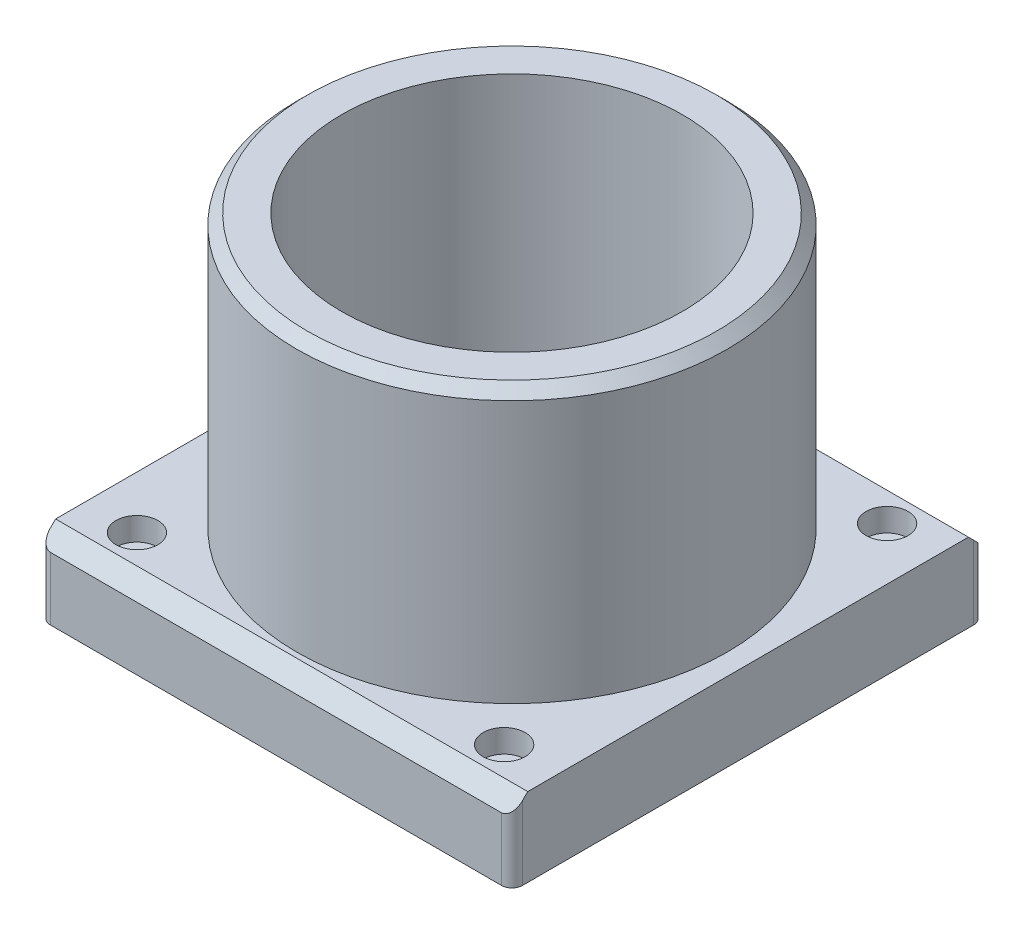
from build123d import *

# Parameters (mm, degrees)
ESQUISSE1_W                                        = 90
ESQUISSE1_H                                        = 90
BOSS_EXTRU_1_DEPTH                                 = 15
ESQUISSE2_R                                        = 41
BOSS_EXTRU_2_DEPTH                                 = 52
CHANFREIN1_SIZE                                    = 3
CONG_1_R                                           = 2
CHANFREIN2_SIZE                                    = 2
CHAMBRAGE_POUR_VIS_T_TE_HEXAGONALE_M41_D           = 4.5
CHAMBRAGE_POUR_VIS_T_TE_HEXAGONALE_M41_CBORE_D     = 8
CHAMBRAGE_POUR_VIS_T_TE_HEXAGONALE_M41_CBORE_DEPTH = 4.4
ESQUISSE6_R                                        = 32.5
ENL_V_MAT_EXTRU_1_DEPTH                            = 93.406709713


with BuildPart() as part:
    # Esquisse1 → Boss.-Extru.1 (new body)
    with BuildSketch(Plane(origin=(0, 0, 0), x_dir=(1, 0, 0), z_dir=(0, 1, 0))):
        Rectangle(ESQUISSE1_W, ESQUISSE1_H)
    extrude(amount=BOSS_EXTRU_1_DEPTH)

    # Esquisse2 → Boss.-Extru.2 (add)
    with BuildSketch(Plane(origin=(0, 15, 0), x_dir=(1, 0, 0), z_dir=(0, 1, 0))):
        with Locations(Location((0, 0, 0), (0, 0, 90))):
            Circle(ESQUISSE2_R)
    extrude(amount=BOSS_EXTRU_2_DEPTH)

    # Chanfrein1
    chanfrein1_edges = [part.edges().sort_by_distance(p)[0] for p in [
        (0, 15, -45),
        (0, 15, 45),
    ]]
    chamfer(chanfrein1_edges, length=CHANFREIN1_SIZE)

    # Congé1
    cong_1_edges = [part.edges().sort_by_distance(p)[0] for p in [
        (-45, 6, 45),
        (-45, 6, -45),
        (45, 6, -45),
        (45, 6, 45),
    ]]
    fillet(cong_1_edges, radius=CONG_1_R)

    # Chanfrein2
    chanfrein2_edges = [part.edges().sort_by_distance(p)[0] for p in [
        (0, 67, 41),
    ]]
    chamfer(chanfrein2_edges, length=CHANFREIN2_SIZE)

    # Chambrage pour vis à tête hexagonale M41 (through all)
    with Locations(Plane(origin=(0, 15, 0), x_dir=(1, 0, 0), z_dir=(0, 1, 0))):
        with Locations((-35, 36.5), (35, 36.5), (-35, -36.5), (35, -36.5)):
            CounterBoreHole(CHAMBRAGE_POUR_VIS_T_TE_HEXAGONALE_M41_D / 2, CHAMBRAGE_POUR_VIS_T_TE_HEXAGONALE_M41_CBORE_D / 2, CHAMBRAGE_POUR_VIS_T_TE_HEXAGONALE_M41_CBORE_DEPTH)

    # Esquisse6 → Enlèv. mat.-Extru.1 (cut, through all)
    with BuildSketch(Plane(origin=(0, 67, 0), x_dir=(1, 0, 0), z_dir=(0, 1, 0))):
        with Locations(Location((0, 0, 0), (0, 0, 270))):
            Circle(ESQUISSE6_R)
    extrude(amount=-ENL_V_MAT_EXTRU_1_DEPTH, mode=Mode.SUBTRACT)


solid = part.part
